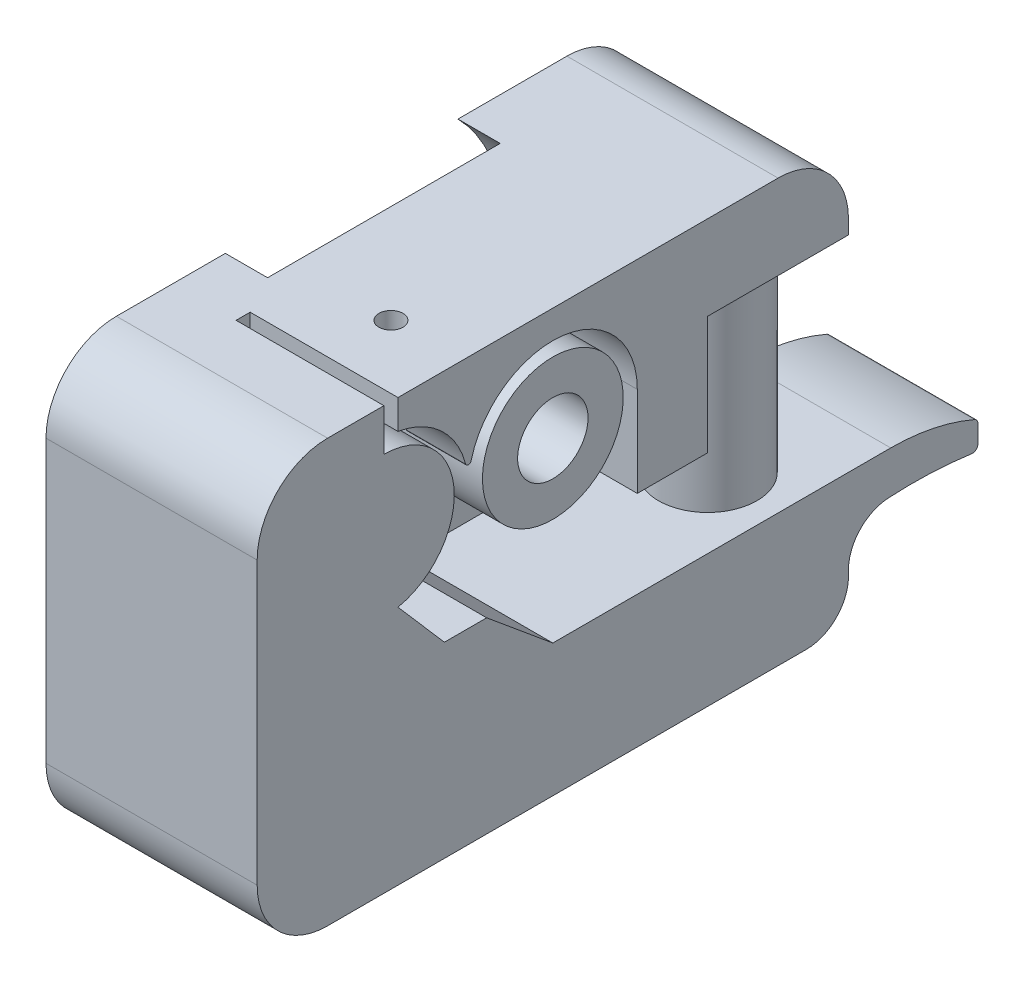
from build123d import *

# Parameters (mm, degrees)
SKETCH1_W           = 42
SKETCH1_H           = 30
BOSS_EXTRUDE1_DEPTH = 15
FILLET1_R           = 5
CUT_EXTRUDE1_DEPTH  = 10.5
FILLET2_R           = 0.2
SKETCH3_R           = 3.5
BOSS_EXTRUDE2_DEPTH = 14.6
SKETCH4_R           = 5
BOSS_EXTRUDE3_DEPTH = 10.5
SKETCH5_R           = 3
CUT_EXTRUDE2_DEPTH  = 2
CUT_EXTRUDE2_DRAFT  = -47
SKETCH6_R           = 0.85526258
CUT_EXTRUDE3_DEPTH  = 39.078865697
SKETCH7_R           = 2.5
CUT_EXTRUDE4_DEPTH  = 30.849623234
BOSS_EXTRUDE4_DEPTH = 10.5
FILLET3_R           = 3
FILLET4_R           = 0.4
SKETCH9_R           = 11.5
CUT_EXTRUDE5_DEPTH  = 3


with BuildPart() as part:
    # Sketch1 → Boss-Extrude1 (new body)
    with BuildSketch(Plane(origin=(0, 0, 0), x_dir=(0, 0, -1), z_dir=(1, 0, 0))):
        Rectangle(SKETCH1_W, SKETCH1_H)
    extrude(amount=BOSS_EXTRUDE1_DEPTH)

    # Fillet1
    fillet1_edges = [part.edges().sort_by_distance(p)[0] for p in [
        (7.5, 15, 21),
        (7.5, 15, -21),
        (7.5, -15, 21),
    ]]
    fillet(fillet1_edges, radius=FILLET1_R)

    # Sketch2 → Cut-Extrude1 (cut)
    with BuildSketch(Plane(origin=(15, 0, 0), x_dir=(0, 0, -1), z_dir=(1, 0, 0))):
        with BuildLine():
            Line((21, 9), (11, 9))
            Line((11, 9), (11, 0.6))
            Line((11, 0.6), (6, 0.6))
            Line((6, 0.6), (6, 7))
            ThreePointArc((6, 7), (0, 13), (-6, 7))
            ThreePointArc((-6, 7), (-7.417424305, 10.872983346), (-11, 12.916079783))
            Line((-11, 12.916079783), (-11, 15))
            Line((-11, 15), (-12, 15))
            Line((-12, 15), (-12, 12))
            ThreePointArc((-12, 12), (-7.025319235, 7.50254481), (-11, 2.101020514))
            Line((-11, 2.101020514), (-7.7, -1.7))
            Line((-7.7, -1.7), (-4.7, -1.7))
            Line((-4.7, -1.7), (0, -5.6))
            Line((0, -5.6), (11, -5.6))
            Line((11, -5.6), (21, -5.6))
            Line((21, -5.6), (21, 9))
        make_face()
    extrude(amount=-CUT_EXTRUDE1_DEPTH, mode=Mode.SUBTRACT)

    # Fillet2
    fillet2_edges = [part.edges().sort_by_distance(p)[0] for p in [
        (9.75, 7, 6),
    ]]
    fillet(fillet2_edges, radius=FILLET2_R)

    # Sketch3 → Boss-Extrude2 (add)
    with BuildSketch(Plane(origin=(0, -5.6, 0), x_dir=(1, 0, 0), z_dir=(0, 1, 0))):
        with Locations(Location((10, 16, 0), (0, 0, 90))):
            Circle(SKETCH3_R)
    extrude(amount=BOSS_EXTRUDE2_DEPTH)

    # Sketch4 → Boss-Extrude3 (add)
    with BuildSketch(Plane(origin=(4.5, 0, 0), x_dir=(0, 0, -1), z_dir=(1, 0, 0))):
        with Locations(Location((0, 7, 0), (0, 0, 180))):
            Circle(SKETCH4_R)
    extrude(amount=BOSS_EXTRUDE3_DEPTH)


with BuildPart() as cut_extrude2_tool:
    # Sketch5 → Cut-Extrude2 (with draft: the straight prism first)
    with BuildSketch(Plane.XZ.offset(15)):
        with Locations((10, 6.5)):
            Circle(SKETCH5_R)
    extrude(amount=-CUT_EXTRUDE2_DEPTH)
    # Cut-Extrude2: the draft: its side faces are tilted about the plane it starts from
    cut_extrude2_sides = [cut_extrude2_tool.faces().sort_by_distance(p)[0] for p in [
        (7, -14, 6.5),
    ]]
    draft(cut_extrude2_sides, Plane.XZ.offset(15), CUT_EXTRUDE2_DRAFT)


with BuildPart() as part_1:
    add(part.part)

    # Cut-Extrude2: cut by cut_extrude2_tool
    add(cut_extrude2_tool.part, mode=Mode.SUBTRACT)

    # Sketch6 → Cut-Extrude3 (cut, through all)
    with BuildSketch(Plane.XZ.offset(13)):
        with Locations(Location((10, 6.5, 0), (0, 0, 270))):
            Circle(SKETCH6_R)
    extrude(amount=-CUT_EXTRUDE3_DEPTH, mode=Mode.SUBTRACT)

    # Sketch7 → Cut-Extrude4 (cut, through all)
    with BuildSketch(Plane(origin=(15, 0, 0), x_dir=(0, 0, -1), z_dir=(1, 0, 0))):
        with Locations((0, 7)):
            Circle(SKETCH7_R)
    extrude(amount=-CUT_EXTRUDE4_DEPTH, mode=Mode.SUBTRACT)

    # Sketch8 → Boss-Extrude4 (add)
    with BuildSketch(Plane(origin=(15, 0, 0), x_dir=(0, 0, -1), z_dir=(1, 0, 0))):
        with BuildLine():
            Line((21, -5.6), (24, -5.6))
            ThreePointArc((24, -5.6), (27.171714604, -5.939160103), (30.2, -6.941303137))
            Line((30.2, -6.941303137), (30.2, -8.9))
            ThreePointArc((30.2, -8.9), (25.6, -8.545235705), (21, -8.9))
            Line((21, -8.9), (21, -5.6))
        make_face()
    extrude(amount=-BOSS_EXTRUDE4_DEPTH)

    # Fillet3
    fillet3_edges = [part_1.edges().sort_by_distance(p)[0] for p in [
        (9.75, -8.9, -21),
        (7.5, -15, -21),
    ]]
    fillet(fillet3_edges, radius=FILLET3_R)

    # Fillet4
    fillet4_edges = [part_1.edges().sort_by_distance(p)[0] for p in [
        (9.75, -6.941303137, -30.2),
        (9.75, -8.9, -30.2),
    ]]
    fillet(fillet4_edges, radius=FILLET4_R)

    # Sketch9 → Cut-Extrude5 (cut)
    with BuildSketch(Plane.ZY):
        with Locations((0, 7)):
            Circle(SKETCH9_R)
    extrude(amount=-CUT_EXTRUDE5_DEPTH, mode=Mode.SUBTRACT)


solid = part_1.part
